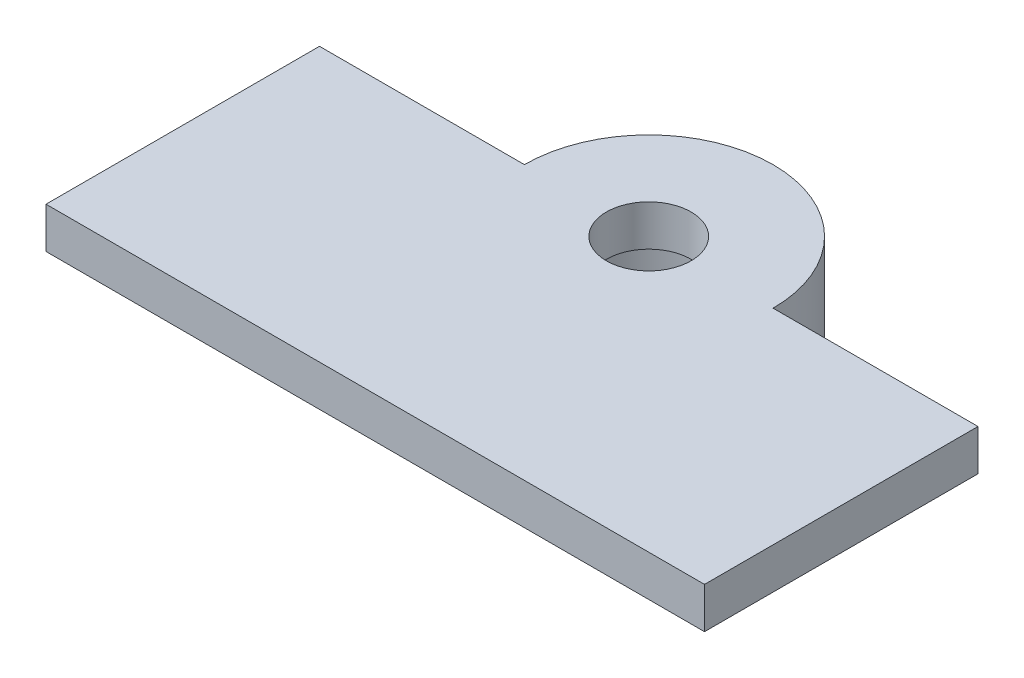
from build123d import *

# Parameters (mm, degrees)
SKETCH1_R           = 9.1
SKETCH1_R_2         = 6.1
BOSS_EXTRUDE1_DEPTH = 10
SKETCH2_R           = 9.1
SKETCH2_R_2         = 3.1
BOSS_EXTRUDE2_DEPTH = 3
BOSS_EXTRUDE3_DEPTH = 3


with BuildPart() as part:
    # Sketch1 → Boss-Extrude1 (new body)
    with BuildSketch(Plane(origin=(0, 0, 0), x_dir=(1, 0, 0), z_dir=(0, 1, 0))):
        with Locations(Location((0, 0, 0), (0, 0, 270))):
            Circle(SKETCH1_R)
        with Locations(Location((0, 0, 0), (0, 0, 270))):
            Circle(SKETCH1_R_2, mode=Mode.SUBTRACT)
    extrude(amount=BOSS_EXTRUDE1_DEPTH)

    # Sketch2 → Boss-Extrude2 (add)
    with BuildSketch(Plane(origin=(0, 10, 0), x_dir=(1, 0, 0), z_dir=(0, 1, 0))):
        with Locations(Location((0, 0, 0), (0, 0, 270))):
            Circle(SKETCH2_R)
        with Locations(Location((0, 0, 0), (0, 0, 270))):
            Circle(SKETCH2_R_2, mode=Mode.SUBTRACT)
    extrude(amount=BOSS_EXTRUDE2_DEPTH)

    # Sketch3 → Boss-Extrude3 (add)
    with BuildSketch(Plane(origin=(0, 13, 0), x_dir=(1, 0, 0), z_dir=(0, 1, 0))):
        Polygon((-9.1, 0), (-24.1, 0), (-24.1, -20.018492189), (24.1, -20.018492189), (24.1, 0), (9.1, 0), (0, -6.029666322), align=None)
    extrude(amount=-BOSS_EXTRUDE3_DEPTH)


solid = part.part
